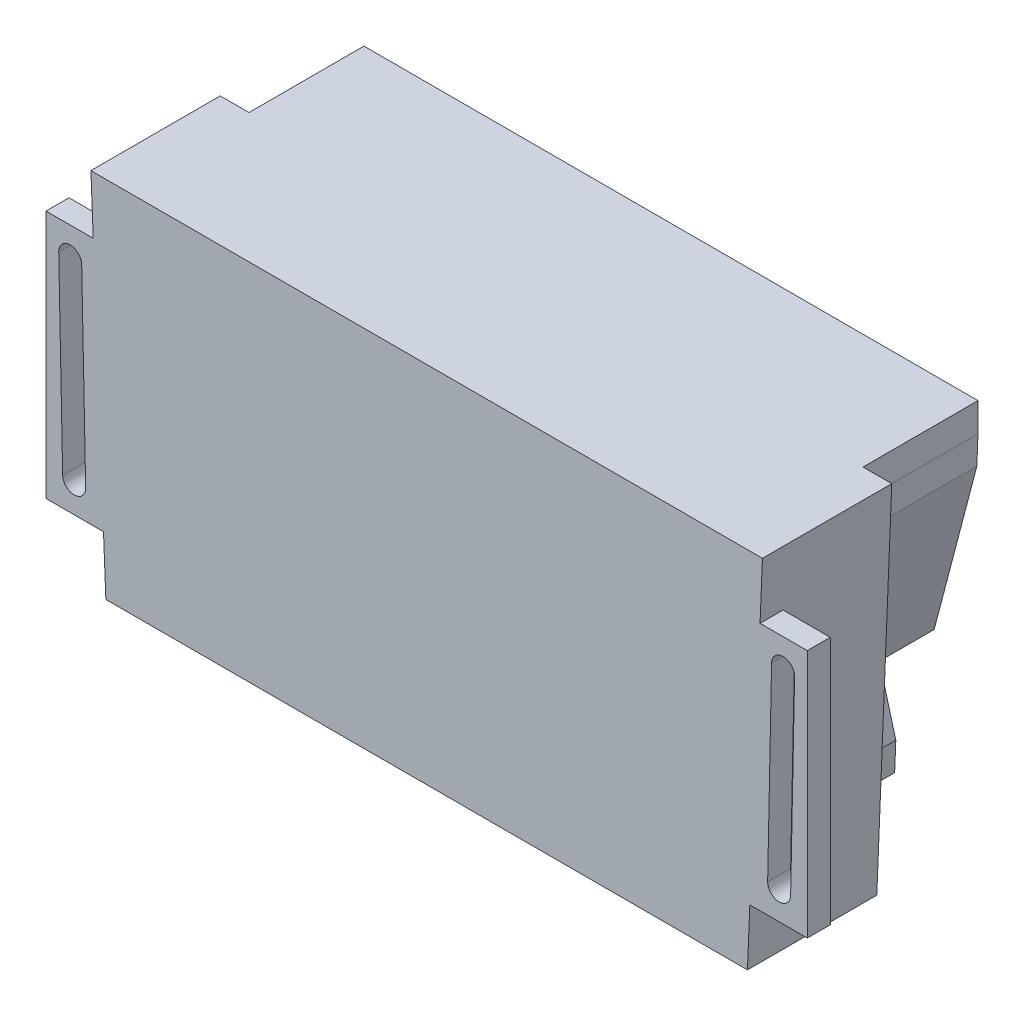
from build123d import *

# Parameters (mm, degrees)
BOSS_EXTRUDE1_DEPTH = 20
SKETCH2_W           = 106.8
SKETCH2_H           = 20
BOSS_EXTRUDE2_DEPTH = 5
BOSS_EXTRUDE3_DEPTH = 12.5
SKETCH4_W           = 90.804234884
SKETCH4_H           = 53.3
BOSS_EXTRUDE4_DEPTH = 10
SKETCH7_R           = 2.9
CUT_EXTRUDE3_DEPTH  = 129.904719117
BOSS_EXTRUDE6_START = 53.3
SKETCH8_R           = 2.9
SKETCH8_W           = 10
SKETCH8_H           = 10
BOSS_EXTRUDE6_DEPTH = 53.3
BOSS_EXTRUDE7_DEPTH = 22.5
SKETCH12_R          = 2.9
CUT_EXTRUDE6_DEPTH  = 132.051236585
BOSS_EXTRUDE8_DEPTH = 4


with BuildPart() as part:
    # Sketch1 → Boss-Extrude1 (new body)
    with BuildSketch(Plane.XY):
        Polygon((-2.4, 58.3), (-1.02915952, 25), (-0.02915952, 25), (2.6, 35.023161884), (2.6, 58.3), align=None)
        Polygon((7.6, 58.3), (2.6, 58.3), (2.6, 35.023161884), (7.394168096, 53.3), align=None)
        Polygon((19.7, 58.3), (9.7, 58.3), (11.07084048, 25), (12.07084048, 25), (19.494168096, 53.3), align=None)
        Polygon((31.8, 58.3), (21.8, 58.3), (23.17084048, 25), (24.17084048, 25), (31.594168096, 53.3), align=None)
        Polygon((43.9, 58.3), (33.9, 58.3), (35.27084048, 25), (36.27084048, 25), (43.694168096, 53.3), align=None)
        Polygon((56, 58.3), (46, 58.3), (47.37084048, 25), (48.37084048, 25), (55.794168096, 53.3), align=None)
        Polygon((68.1, 58.3), (58.1, 58.3), (59.47084048, 25), (60.47084048, 25), (67.894168096, 53.3), align=None)
        Polygon((80.2, 58.3), (70.2, 58.3), (71.57084048, 25), (72.57084048, 25), (79.994168096, 53.3), align=None)
        Polygon((92.3, 58.3), (82.3, 58.3), (83.67084048, 25), (84.67084048, 25), (92.094168096, 53.3), align=None)
        Polygon((104.4, 58.3), (94.4, 58.3), (95.77084048, 25), (96.77084048, 25), (104.194168096, 53.3), align=None)
        Polygon((84.67084048, 25), (83.67084048, 25), (84.7, 0), (89.9, 0), (90.105831904, 5), align=None)
        Polygon((72.57084048, 25), (71.57084048, 25), (72.6, 0), (77.8, 0), (78.005831904, 5), align=None)
        Polygon((60.47084048, 25), (59.47084048, 25), (60.5, 0), (65.7, 0), (65.905831904, 5), align=None)
        Polygon((48.37084048, 25), (47.37084048, 25), (48.4, 0), (53.6, 0), (53.805831904, 5), align=None)
        Polygon((36.27084048, 25), (35.27084048, 25), (36.3, 0), (41.5, 0), (41.705831904, 5), align=None)
        Polygon((24.17084048, 25), (23.17084048, 25), (24.2, 0), (29.4, 0), (29.605831904, 5), align=None)
        Polygon((12.07084048, 25), (11.07084048, 25), (12.1, 0), (17.3, 0), (17.505831904, 5), align=None)
    extrude(amount=BOSS_EXTRUDE1_DEPTH)

    # Sketch2 → Boss-Extrude2 (add)
    with BuildSketch(Plane(origin=(0, 58.3, 0), x_dir=(1, 0, 0), z_dir=(0, 1, 0))):
        with Locations((51, -10)):
            Rectangle(SKETCH2_W, SKETCH2_H)
    extrude(amount=BOSS_EXTRUDE2_DEPTH)

    # Sketch3 → Boss-Extrude3 (add)
    with BuildSketch(Plane.XY.offset(20)):
        Polygon((109.404234884, 63.3), (107.004234884, 5), (-5, 5), (-7.4, 63.3), align=None)
    extrude(amount=BOSS_EXTRUDE3_DEPTH)

    # Sketch4 → Boss-Extrude4 (add)
    with BuildSketch(Plane.XY.offset(32.5)):
        Polygon((-5, 5), (107.004234884, 5), (107.210066788, 10), (106.404234884, 10), (96.404234884, 10), (5.6, 10), (-4.4, 10), (-5.205831904, 10), align=None)
        Polygon((-7.4, 63.3), (-5.205831904, 10), (-4.4, 10), (-4.4, 63.3), align=None)
        Polygon((107.210066788, 10), (109.404234884, 63.3), (106.404234884, 63.3), (106.404234884, 10), align=None)
        with Locations((51.002117442, 36.65)):
            Rectangle(SKETCH4_W, SKETCH4_H)
    extrude(amount=BOSS_EXTRUDE4_DEPTH)

    # Sketch7 → Cut-Extrude3 (cut, through all)
    with BuildSketch(Plane(origin=(0, 10, 0), x_dir=(1, 0, 0), z_dir=(0, 1, 0))):
        with Locations(Location((101.404234884, -29.5, 0), (0, 0, 180))):
            Circle(SKETCH7_R)
        with Locations(Location((0.6, -29.5, 0), (0, 0, 180))):
            Circle(SKETCH7_R)
    extrude(amount=-CUT_EXTRUDE3_DEPTH, mode=Mode.SUBTRACT)

    # Sketch8 → Boss-Extrude6 (add)
    with BuildSketch(Plane(origin=(0, 10, 0), x_dir=(1, 0, 0), z_dir=(0, 1, 0)).offset(BOSS_EXTRUDE6_START)):
        with Locations(Location((101.404234884, -29.5, 0), (0, 0, 180))):
            Circle(SKETCH8_R)
        with Locations(Location((0.6, -29.5, 0), (0, 0, 180))):
            Circle(SKETCH8_R)
        with Locations((101.404234884, -37.5)):
            Rectangle(SKETCH8_W, SKETCH8_H)
        with Locations((0.6, -37.5)):
            Rectangle(SKETCH8_W, SKETCH8_H)
    extrude(amount=-BOSS_EXTRUDE6_DEPTH)

    # Sketch10 → Boss-Extrude7 (add)
    with BuildSketch(Plane.XY.offset(20)):
        Polygon((-5, 5), (-4.794168096, 0), (106.79840298, 0), (107.004234884, 5), align=None)
    extrude(amount=BOSS_EXTRUDE7_DEPTH)

    # Sketch12 → Cut-Extrude6 (cut, through all)
    with BuildSketch(Plane(origin=(0, 5, 0), x_dir=(1, 0, 0), z_dir=(0, 1, 0))):
        with Locations(Location((101.404234884, -29.5, 0), (0, 0, 180))):
            Circle(SKETCH12_R)
        with Locations(Location((0.6, -29.5, 0), (0, 0, 180))):
            Circle(SKETCH12_R)
    extrude(amount=-CUT_EXTRUDE6_DEPTH, mode=Mode.SUBTRACT)

    # Sketch13 → Boss-Extrude8 (add)
    # profile 1 of 2: a face of its own
    with BuildSketch(Plane.XY.offset(42.5)):
        Polygon((108.992571076, 53.3), (107.210066788, 10), (117.210066788, 10), (117.210066788, 53.3), align=None)
        with BuildLine():
            Line((110.313406273, 15.041157663), (110.998826513, 48.341157663))
            ThreePointArc((110.998826513, 48.341157663), (113.039560643, 50.299576467), (114.997979447, 48.258842337))
            Line((114.997979447, 48.258842337), (114.312559207, 14.958842337))
            ThreePointArc((114.312559207, 14.958842337), (112.271825077, 13.000423533), (110.313406273, 15.041157663))
        make_face(mode=Mode.SUBTRACT)
    # profile 2 of 2: a face of its own
    with BuildSketch(Plane.XY.offset(42.5)):
        Polygon((-15.205831904, 10), (-15.205831904, 53.3), (-6.988336192, 53.3), (-5.205831904, 10), align=None)
        with BuildLine():
            Line((-8.309171389, 15.041157663), (-8.994591629, 48.341157663))
            ThreePointArc((-8.994591629, 48.341157663), (-11.035325759, 50.299576467), (-12.993744563, 48.258842337))
            Line((-12.993744563, 48.258842337), (-12.308324323, 14.958842337))
            ThreePointArc((-12.308324323, 14.958842337), (-10.267590193, 13.000423533), (-8.309171389, 15.041157663))
        make_face(mode=Mode.SUBTRACT)
    extrude(amount=-BOSS_EXTRUDE8_DEPTH)


solid = part.part
